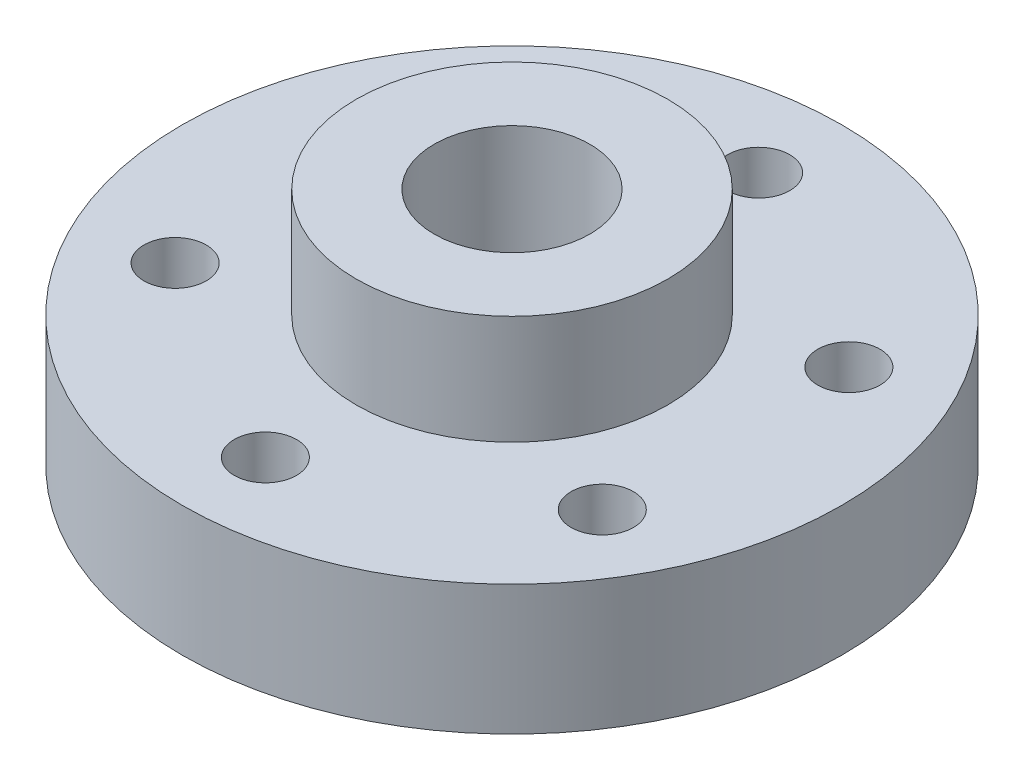
from build123d import *

# Parameters (mm, degrees)
SKETCH1_R           = 12.7
SKETCH1_R_2         = 3
BOSS_EXTRUDE1_DEPTH = 5
SKETCH2_R           = 6
SKETCH2_R_2         = 3
BOSS_EXTRUDE2_DEPTH = 4.2
SKETCH3_R           = 1.2
CUT_EXTRUDE1_DEPTH  = 19.643497526


with BuildPart() as part:
    # Sketch1 → Boss-Extrude1 (new body)
    with BuildSketch(Plane(origin=(0, 0, 0), x_dir=(1, 0, 0), z_dir=(0, 1, 0))):
        with Locations(Location((0, 0, 0), (0, 0, 270))):
            Circle(SKETCH1_R)
        with Locations(Location((0, 0, 0), (0, 0, 270))):
            Circle(SKETCH1_R_2, mode=Mode.SUBTRACT)
    extrude(amount=BOSS_EXTRUDE1_DEPTH)

    # Sketch2 → Boss-Extrude2 (add)
    with BuildSketch(Plane(origin=(0, 5, 0), x_dir=(1, 0, 0), z_dir=(0, 1, 0))):
        with Locations(Location((0, 0, 0), (0, 0, 270))):
            Circle(SKETCH2_R)
        with Locations(Location((0, 0, 0), (0, 0, 270))):
            Circle(SKETCH2_R_2, mode=Mode.SUBTRACT)
    extrude(amount=BOSS_EXTRUDE2_DEPTH)

    # Sketch3 → Cut-Extrude1 (cut, through all)
    with BuildSketch(Plane(origin=(0, 5, 0), x_dir=(1, 0, 0), z_dir=(0, 1, 0))):
        with Locations(Location((0, 9.5, 0), (0, 0, 270))):
            Circle(SKETCH3_R)
        with Locations(Location((8.227241336, 4.75, 0), (0, 0, 270))):
            Circle(SKETCH3_R)
        with Locations(Location((8.227241336, -4.75, 0), (0, 0, 270))):
            Circle(SKETCH3_R)
        with Locations(Location((0, -9.5, 0), (0, 0, 270))):
            Circle(SKETCH3_R)
        with Locations(Location((-8.227241336, -4.75, 0), (0, 0, 270))):
            Circle(SKETCH3_R)
        with Locations(Location((-8.227241336, 4.75, 0), (0, 0, 270))):
            Circle(SKETCH3_R)
    extrude(amount=-CUT_EXTRUDE1_DEPTH, mode=Mode.SUBTRACT)


solid = part.part
